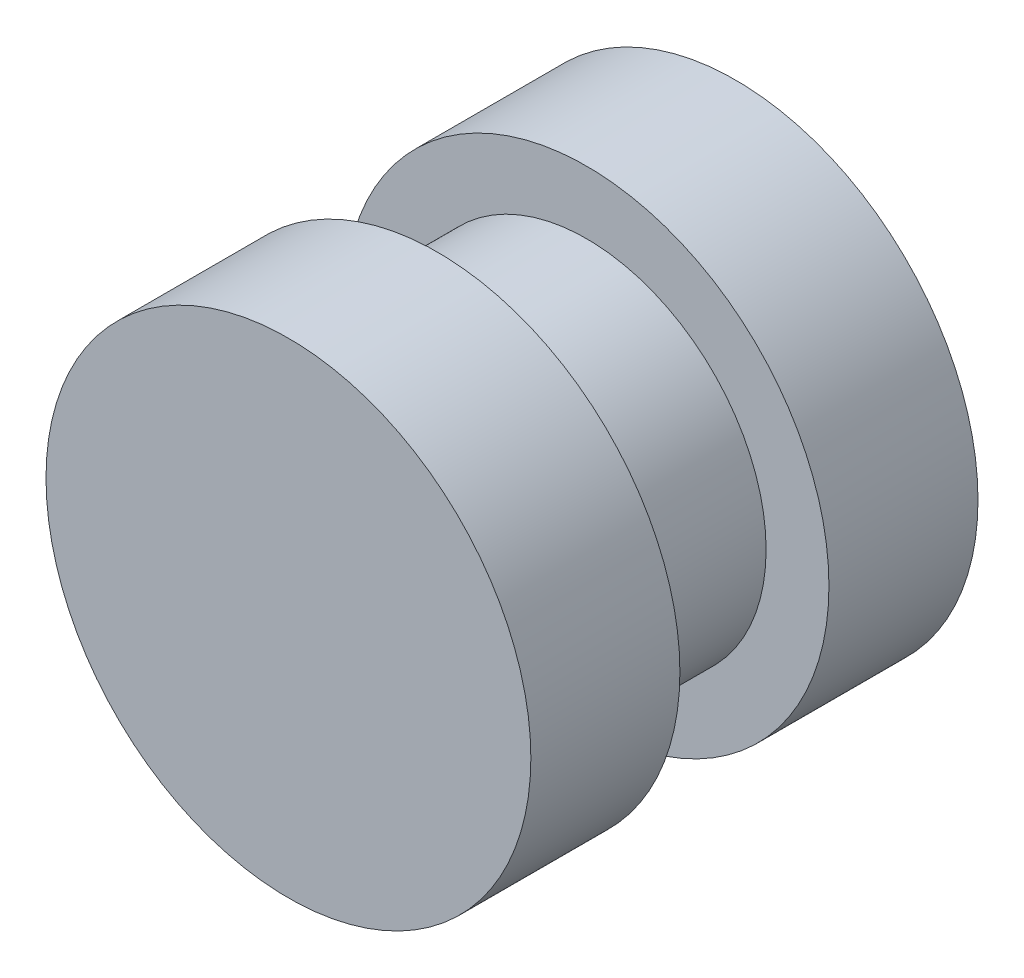
from build123d import *

# Parameters (mm, degrees)
SKETCH1_R           = 10
BOSS_EXTRUDE1_DEPTH = 8.3
SKETCH2_R           = 13.5
BOSS_EXTRUDE4_DEPTH = 8.3
BOSS_EXTRUDE5_START = 8.3
SKETCH3_R           = 13.5
BOSS_EXTRUDE5_DEPTH = 8.3


with BuildPart() as part:
    # Sketch1 → Boss-Extrude1 (new body)
    with BuildSketch(Plane.XY):
        with Locations(Location((0, 0, 0), (0, 0, 180))):
            Circle(SKETCH1_R)
    extrude(amount=BOSS_EXTRUDE1_DEPTH)

    # Sketch2 → Boss-Extrude4 (add)
    with BuildSketch(Plane.XY.offset(8.3)):
        with Locations(Location((0, 0, 0), (0, 0, 180))):
            Circle(SKETCH2_R)
    extrude(amount=BOSS_EXTRUDE4_DEPTH)

    # Sketch3 → Boss-Extrude5 (add)
    with BuildSketch(Plane(origin=(0, 0, 0), x_dir=(-1, 0, 0), z_dir=(0, 0, -1)).offset(BOSS_EXTRUDE5_START)):
        Circle(SKETCH3_R)
    extrude(amount=-BOSS_EXTRUDE5_DEPTH)


solid = part.part
